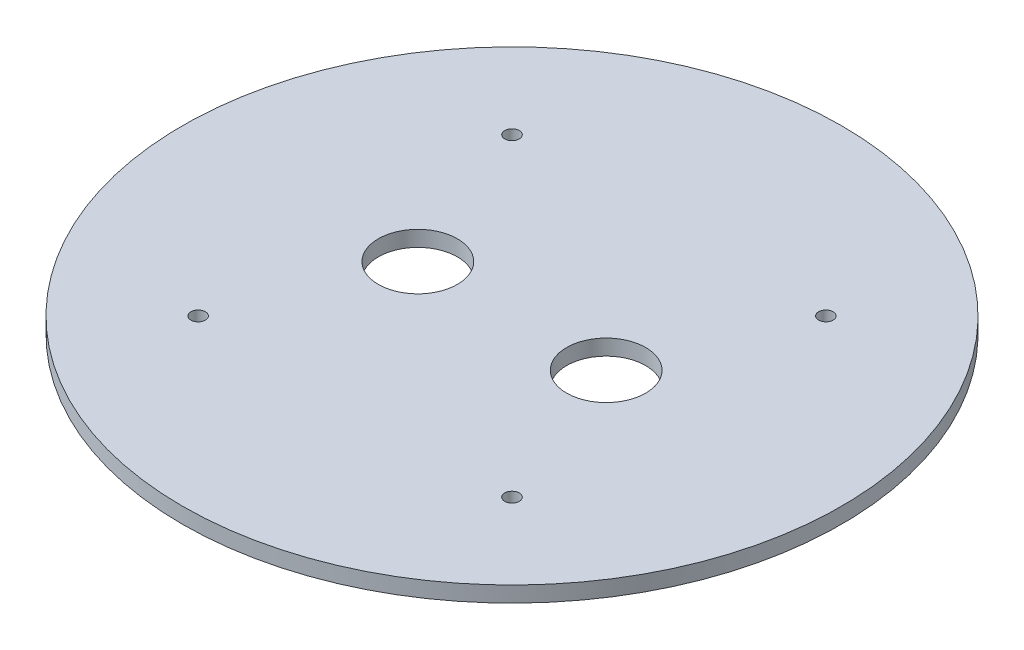
from build123d import *

# Parameters (mm, degrees)
SKETCH1_R             = 66.675
BOSS_EXTRUDE1_DEPTH   = 3.175
HOLE1_D               = 16.002
F_4_CLEARANCE_HOLE1_D = 2.9464
LPATTERN1_COUNT       = 2
LPATTERN1_PITCH       = 63.5
LPATTERN1_COUNT_DIR2  = 2
LPATTERN1_PITCH_DIR2  = 63.5


with BuildPart() as part:
    # Sketch1 → Boss-Extrude1 (new body)
    with BuildSketch(Plane(origin=(0, 0, 0), x_dir=(1, 0, 0), z_dir=(0, 1, 0))):
        with Locations(Location((0, 0, 0), (0, 0, 270))):
            Circle(SKETCH1_R)
    extrude(amount=BOSS_EXTRUDE1_DEPTH)

    # Hole1 (through all)
    with Locations(Plane(origin=(0, 3.175, 0), x_dir=(1, 0, 0), z_dir=(0, 1, 0))):
        with Locations((19.05, 0)):
            hole1 = Hole(HOLE1_D / 2)

    # Mirror1: Hole1 across plane
    add(hole1.mirror(Plane(origin=(0, 0, 0), x_dir=(0, 0, 1), z_dir=(1, 0, 0))), mode=Mode.SUBTRACT)

    # #4 Clearance Hole1 (through all)
    with Locations(Plane(origin=(0, 3.175, 0), x_dir=(1, 0, 0), z_dir=(0, 1, 0))):
        with Locations((-31.75, 31.75)):
            f_4_clearance_hole1 = Hole(F_4_CLEARANCE_HOLE1_D / 2)

    # LPattern1: 4 Clearance Hole1 2 × 2
    with Locations(*[(i * LPATTERN1_PITCH, 0, j * LPATTERN1_PITCH_DIR2) for i in range(LPATTERN1_COUNT) for j in range(LPATTERN1_COUNT_DIR2) if (i, j) != (0, 0)]):
        add(f_4_clearance_hole1, mode=Mode.SUBTRACT)


solid = part.part
